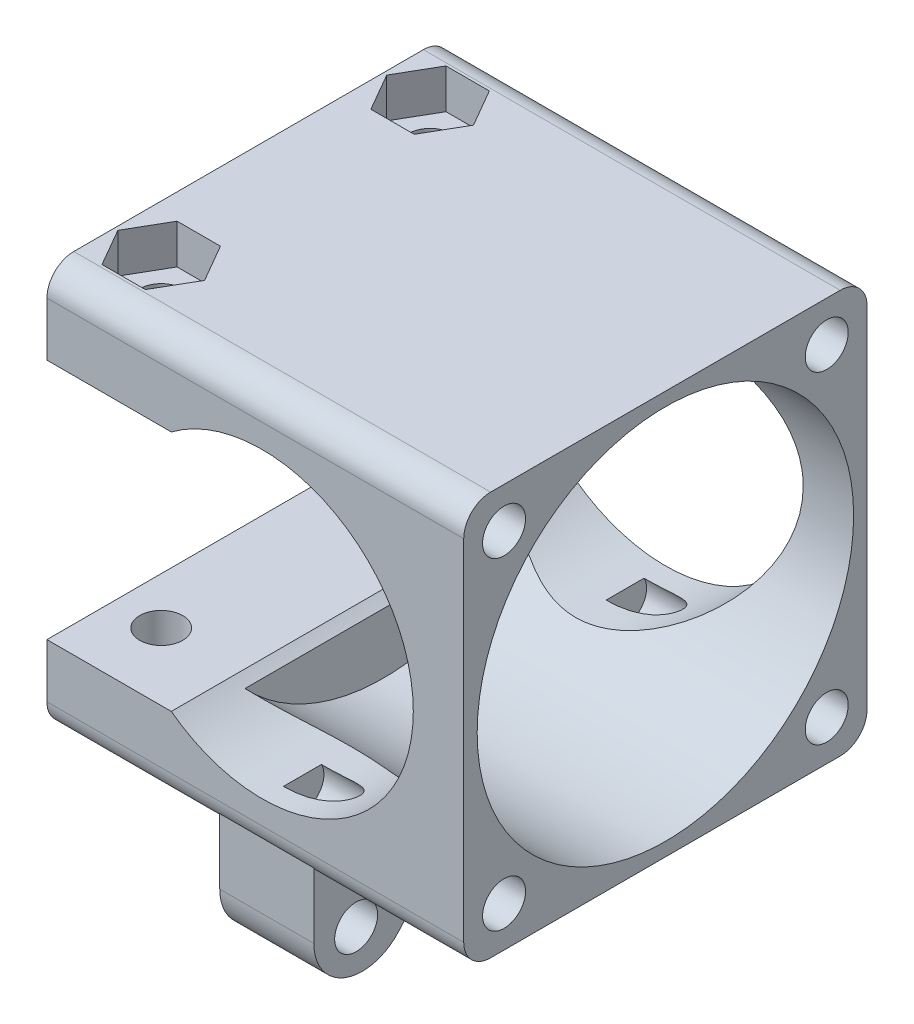
from build123d import *

# Parameters (mm, degrees)
SKETCH1_W           = 30
SKETCH1_H           = 30
BOSS_EXTRUDE1_DEPTH = 15.5
FILLET1_R           = 2
SKETCH2_R           = 14
CUT_EXTRUDE1_DEPTH  = 21
SKETCH3_R           = 1.6
CUT_EXTRUDE2_DEPTH  = 15
CUT_EXTRUDE3_DEPTH  = 37.949289574
SKETCH5_R           = 1.6
CUT_EXTRUDE4_DEPTH  = 46.169126725
CUT_EXTRUDE5_DEPTH  = 2.95
SKETCH7_R           = 2.85
CUT_EXTRUDE6_DEPTH  = 2.95
BOSS_EXTRUDE2_START = -18.5
BOSS_EXTRUDE2_DEPTH = 7
SKETCH9_R           = 1.6
CUT_EXTRUDE7_DEPTH  = 43.320326157


with BuildPart() as part:
    # Sketch1 → Boss-Extrude1 (new, symmetric)
    with BuildSketch(Plane(origin=(0, 0, 0), x_dir=(0, 0, -1), z_dir=(1, 0, 0))):
        with Locations((-15, 0)):
            Rectangle(SKETCH1_W, SKETCH1_H)
    extrude(amount=BOSS_EXTRUDE1_DEPTH, both=True)

    # Fillet1
    fillet1_edges = [part.edges().sort_by_distance(p)[0] for p in [
        (0, -15, 0),
        (0, -15, 30),
        (0, 15, 30),
        (0, 15, 0),
    ]]
    fillet(fillet1_edges, radius=FILLET1_R)

    # Sketch2 → Cut-Extrude1 (cut)
    with BuildSketch(Plane(origin=(15.5, 0, 0), x_dir=(0, 0, -1), z_dir=(1, 0, 0))):
        with Locations((-15, 0)):
            Circle(SKETCH2_R)
    extrude(amount=-CUT_EXTRUDE1_DEPTH, mode=Mode.SUBTRACT)

    # Sketch3 → Cut-Extrude2 (cut)
    with BuildSketch(Plane(origin=(15.5, 0, 0), x_dir=(0, 0, -1), z_dir=(1, 0, 0))):
        with Locations((-27, 12)):
            Circle(SKETCH3_R)
        with Locations((-3, 12)):
            Circle(SKETCH3_R)
        with Locations((-3, -12)):
            Circle(SKETCH3_R)
        with Locations((-27, -12)):
            Circle(SKETCH3_R)
    extrude(amount=-CUT_EXTRUDE2_DEPTH, mode=Mode.SUBTRACT)

    # Sketch4 → Cut-Extrude3 (cut, through all)
    with BuildSketch(Plane.XY.offset(30)):
        with BuildLine():
            Line((-6.25, 9), (-15.5, 9))
            Line((-15.5, 9), (-15.5, -9))
            Line((-15.5, -9), (-6.25, -9))
            ThreePointArc((-6.25, -9), (11.75, 0), (-6.25, 9))
        make_face()
    extrude(amount=-CUT_EXTRUDE3_DEPTH, mode=Mode.SUBTRACT)

    # Sketch5 → Cut-Extrude4 (cut, through all)
    with BuildSketch(Plane(origin=(0, 15, 0), x_dir=(1, 0, 0), z_dir=(0, 1, 0))):
        with Locations(Location((-12, -5, 0), (0, 0, 270))):
            Circle(SKETCH5_R)
        with Locations(Location((-12, -25, 0), (0, 0, 270))):
            Circle(SKETCH5_R)
    extrude(amount=-CUT_EXTRUDE4_DEPTH, mode=Mode.SUBTRACT)

    # Sketch6 → Cut-Extrude5 (cut)
    with BuildSketch(Plane(origin=(0, 15, 0), x_dir=(1, 0, 0), z_dir=(0, 1, 0))):
        Polygon((-10.387287493, -7.7933), (-8.774574986, -5), (-10.387287493, -2.2067), (-13.612712507, -2.2067), (-15.225425014, -5), (-13.612712507, -7.7933), align=None)
        Polygon((-8.774574986, -25), (-10.387287493, -22.2067), (-13.612712507, -22.2067), (-15.225425014, -25), (-13.612712507, -27.7933), (-10.387287493, -27.7933), align=None)
    extrude(amount=-CUT_EXTRUDE5_DEPTH, mode=Mode.SUBTRACT)

    # Sketch7 → Cut-Extrude6 (cut)
    with BuildSketch(Plane.XZ.offset(15)):
        with Locations(Location((-12, 25, 0), (0, 0, 270))):
            Circle(SKETCH7_R)
        with Locations(Location((-12, 5, 0), (0, 0, 270))):
            Circle(SKETCH7_R)
    extrude(amount=-CUT_EXTRUDE6_DEPTH, mode=Mode.SUBTRACT)

    # Sketch8 → Boss-Extrude2 (add)
    with BuildSketch(Plane(origin=(15.5, 0, 0), x_dir=(0, 0, -1), z_dir=(1, 0, 0)).offset(BOSS_EXTRUDE2_START)):
        with BuildLine():
            Line((-29.6463, -14.135647969), (-29.6463, -19))
            ThreePointArc((-29.6463, -19), (-27.334438807, -22.361651144), (-23.368134214, -21.405707385))
            Line((-23.368134214, -21.405707385), (-17.6141, -15))
            Line((-17.6141, -15), (-28, -15))
            ThreePointArc((-28, -15), (-28.929705346, -14.770776092), (-29.6463, -14.135647969))
        make_face()
    extrude(amount=BOSS_EXTRUDE2_DEPTH)

    # Sketch9 → Cut-Extrude7 (cut, through all)
    with BuildSketch(Plane(origin=(4, 0, 0), x_dir=(0, 0, -1), z_dir=(1, 0, 0))):
        with Locations((-26.5, -19.5)):
            Circle(SKETCH9_R)
    extrude(amount=-CUT_EXTRUDE7_DEPTH, mode=Mode.SUBTRACT)


solid = part.part
